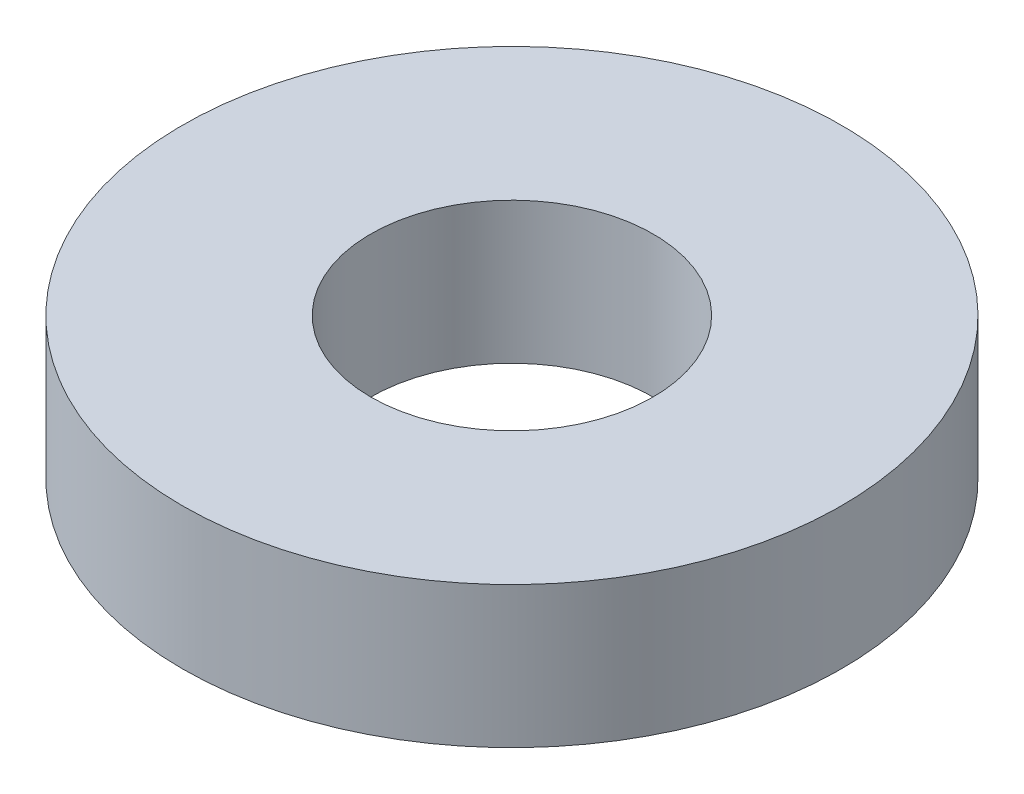
from build123d import *

# Parameters (mm, degrees)
SKETCH1_R           = 7
SKETCH1_R_2         = 3
BOSS_EXTRUDE1_DEPTH = 3


with BuildPart() as part:
    # Sketch1 → Boss-Extrude1 (new body)
    with BuildSketch(Plane(origin=(0, 0, 0), x_dir=(1, 0, 0), z_dir=(0, 1, 0))):
        with Locations(Location((0, 0, 0), (0, 0, 270))):
            Circle(SKETCH1_R)
        with Locations(Location((0, 0, 0), (0, 0, 270))):
            Circle(SKETCH1_R_2, mode=Mode.SUBTRACT)
    extrude(amount=BOSS_EXTRUDE1_DEPTH)


solid = part.part
